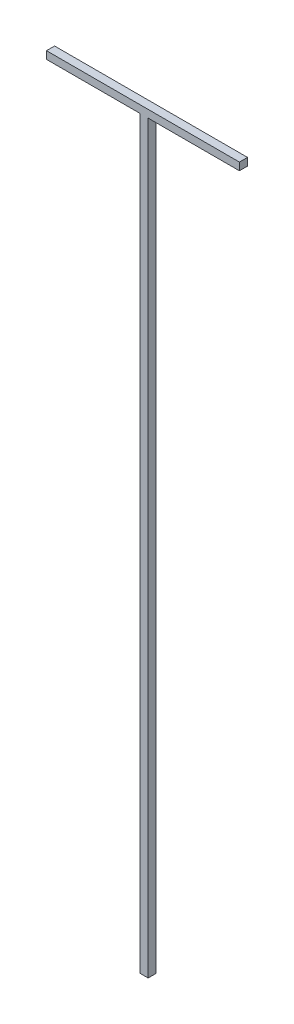
from build123d import *

# Parameters (mm, degrees)
SKETCH_1_W      = 238.070236771
SKETCH_1_H      = 9.336087717
SKETCH_1_W_2    = 10
SKETCH_1_H_2    = 918.957046125
EXTRUDE_1_DEPTH = 10


with BuildPart() as part:
    # Эскиз1 → Бобышка-Вытянуть1 (new body)
    with BuildSketch(Plane.XY):
        with Locations((53.68250437, 36.177339902)):
            Rectangle(SKETCH_1_W, SKETCH_1_H)
        with Locations((55.096797899, -427.96922702)):
            Rectangle(SKETCH_1_W_2, SKETCH_1_H_2)
    extrude(amount=EXTRUDE_1_DEPTH)


solid = part.part
